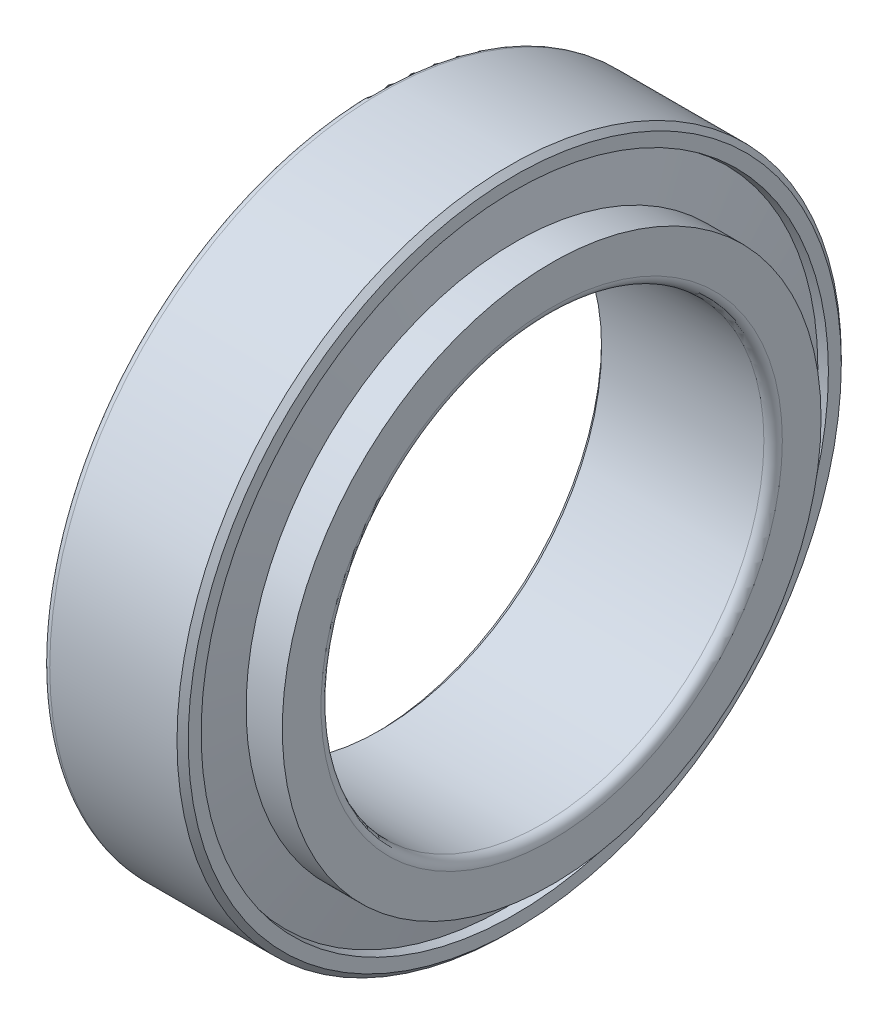
from build123d import *


with BuildPart() as part:
    # OutRacSke → OuterRace (revolve)
    with BuildSketch(Plane.XY):
        with BuildLine():
            Line((-10, 84.981649273), (-48, 77.3885))
            Line((-48, 77.3885), (-48, 88))
            ThreePointArc((-48, 88), (-47.414213562, 89.414213562), (-46, 90))
            Line((-46, 90), (-11.52, 90))
            Line((-11.52, 90), (-10, 88.48))
            Line((-10, 88.48), (-10, 84.981649273))
        make_face()
    revolve(axis=Axis((-42.5, 0, 0), (1, 0, 0)))

    # RolSimSke → RollersSimplified (revolve)
    with BuildSketch(Plane.XY):
        Polygon((-46, 78.177080132), (-12.462978678, 84.878438265), (-9.81770573, 71.640140375), (-43.354727053, 64.938782242), align=None)
    revolve(axis=Axis((0, 0, 0), (-1, 0, 0)))

    # InsRacSke → InnerRace (revolve)
    with BuildSketch(Plane.XY):
        with BuildLine():
            Line((-43.476379, 65.613782241), (-48, 65.613782241))
            Line((-48, 65.613782241), (-48, 61.52))
            Line((-48, 61.52), (-46.48, 60))
            Line((-46.48, 60), (-2.5, 60))
            ThreePointArc((-2.5, 60), (-0.732233047, 60.732233047), (0, 62.5))
            Line((0, 62.5), (0, 72.990140374))
            Line((0, 72.990140374), (-9.804479369, 72.990140374))
            Line((-9.804479369, 72.990140374), (-9.804479369, 71.640140374))
            Line((-9.804479369, 71.640140374), (-43.341500691, 64.938782241))
            Line((-43.341500691, 64.938782241), (-43.476379, 65.613782241))
        make_face()
    revolve(axis=Axis((-42.5, 0, 0), (1, 0, 0)))


solid = part.part
